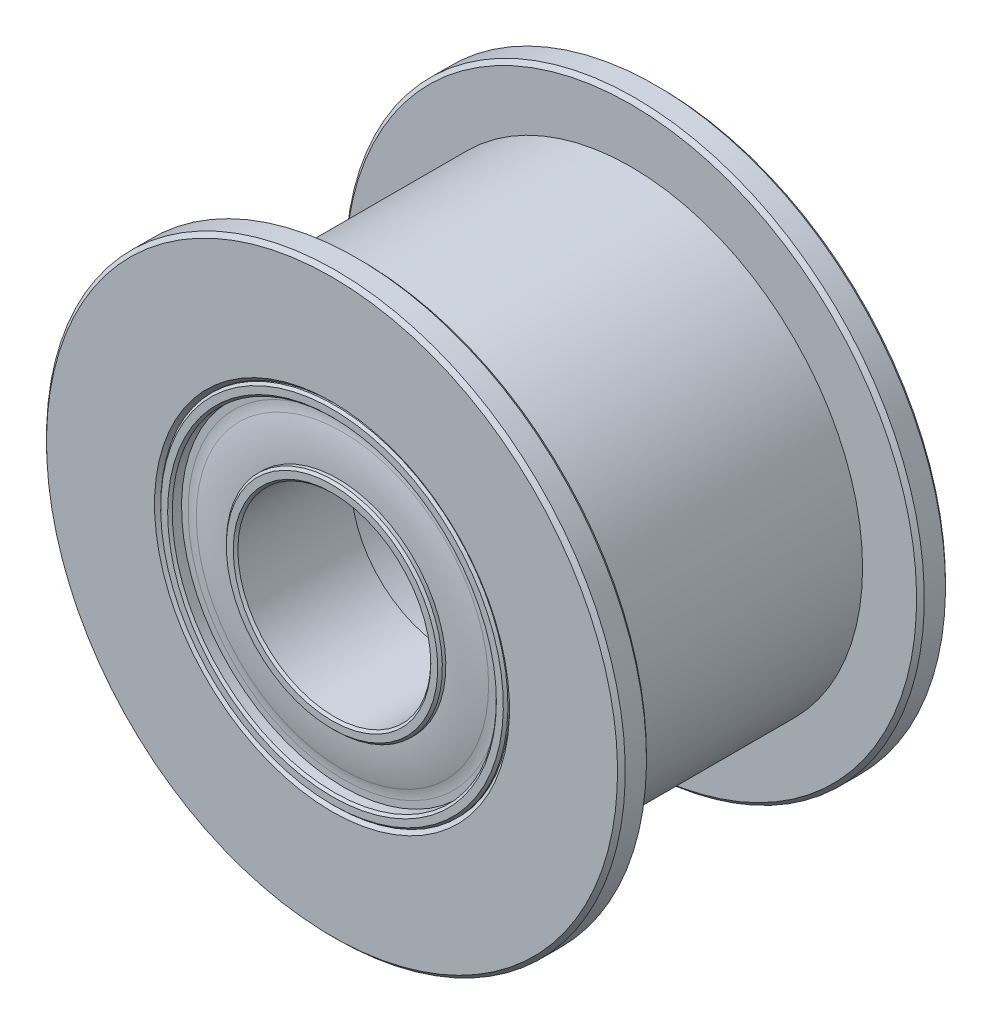
from build123d import *

# Parameters (mm, degrees)
CHAMFER2_SIZE = 0.06
FILLET2_R     = 1
CHAMFER1_SIZE = 0.1


with BuildPart() as part:
    # Sketch2 → Revolve1 (revolve)
    with BuildSketch(Plane(origin=(0, 0, 0), x_dir=(0, 0, -1), z_dir=(1, 0, 0)), mode=Mode.PRIVATE) as revolve1_sk:
        with BuildLine():
            Line((4.25, 2.5), (1.25, 2.5))
            Line((1.25, 2.5), (1.25, 4.5))
            Line((1.25, 4.5), (4.25, 4.5))
            Line((4.25, 4.5), (4.25, 4.2))
            Line((4.25, 4.2), (3.95, 4.2))
            Line((3.95, 4.2), (3.95, 3.9))
            ThreePointArc((3.95, 3.9), (4.062327274, 3.355090083), (4.1, 2.8))
            Line((4.1, 2.8), (4.25, 2.8))
            Line((4.25, 2.8), (4.25, 2.5))
        make_face()
    revolve(revolve1_sk.sketch.rotate(Axis((0, 0, 4.25), (0, 0, -1)), 180), axis=Axis((0, 0, 4.25), (0, 0, -1)))

    # Chamfer2
    chamfer2_edges = [part.edges().sort_by_distance(p)[0] for p in [
        (0, 2.5, -4.25),
        (0, 2.8, -4.25),
        (0, 4.2, -4.25),
        (0, 4.5, -4.25),
    ]]
    chamfer(chamfer2_edges, length=CHAMFER2_SIZE)

    # Fillet2
    fillet2_edges = [part.edges().sort_by_distance(p)[0] for p in [
        (0, 3.9, -3.95),
    ]]
    fillet(fillet2_edges, radius=FILLET2_R)


with BuildPart() as body_2:
    # Mirror1: mirrored copy
    add(part.part.mirror(Plane.XY))


with BuildPart() as body_3:
    # Sketch3 → Revolve2 (revolve)
    with BuildSketch(Plane(origin=(0, 0, 0), x_dir=(0, 0, -1), z_dir=(1, 0, 0)), mode=Mode.PRIVATE) as revolve2_sk:
        Polygon((3.5, 7.5), (4.25, 7.5), (4.25, 4.5), (1.25, 4.5), (1.25, 3.5), (-1.25, 3.5), (-1.25, 4.5), (-4.25, 4.5), (-4.25, 7.5), (-3.5, 7.5), (-3.5, 6), (3.5, 6), align=None)
    revolve(revolve2_sk.sketch.rotate(Axis((0, 0, 4.25), (0, 0, -1)), 180), axis=Axis((0, 0, 4.25), (0, 0, -1)))

    # Chamfer1
    chamfer1_edges = [body_3.edges().sort_by_distance(p)[0] for p in [
        (0, 4.5, 4.25),
        (0, 4.5, -4.25),
        (0, 7.5, -4.25),
        (0, 7.5, -3.5),
        (0, 7.5, 3.5),
        (0, 7.5, 4.25),
    ]]
    chamfer(chamfer1_edges, length=CHAMFER1_SIZE)


solid = Compound([part.part, body_2.part, body_3.part])
